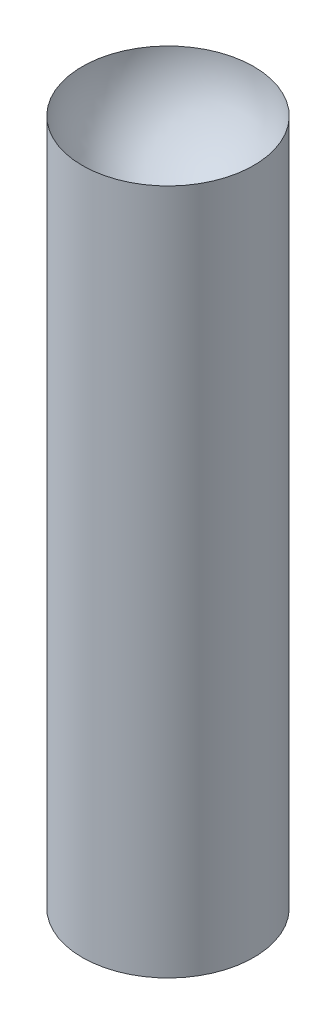
from build123d import *

# Parameters (mm, degrees)
SKETCH1_R           = 12.7
BOSS_EXTRUDE1_DEPTH = 101.6


with BuildPart() as part:
    # Sketch1 → Boss-Extrude1 (new body)
    with BuildSketch(Plane(origin=(0, 0, 0), x_dir=(1, 0, 0), z_dir=(0, 1, 0))):
        with Locations(Location((0, 0, 0), (0, 0, 270))):
            Circle(SKETCH1_R)
    extrude(amount=BOSS_EXTRUDE1_DEPTH)

    # Sketch2 → Cut-Revolve1 (revolve, cut)
    with BuildSketch(Plane(origin=(0, 101.6, 0), x_dir=(1, 0, 0), z_dir=(0, 1, 0))):
        with BuildLine():
            Line((0, 12.7), (0, -12.7))
            ThreePointArc((0, -12.7), (-12.7, 0), (0, 12.7))
        make_face()
    revolve(axis=Axis((0, 101.6, -12.7), (0, 0, 1)), mode=Mode.SUBTRACT)

    # Sketch4 → Cut-Revolve3 (revolve, cut)
    with BuildSketch(Plane(origin=(0, 0, 0), x_dir=(-1, 0, 0), z_dir=(0, -1, 0))):
        with BuildLine():
            Line((0, 11.43), (0, -11.43))
            ThreePointArc((0, -11.43), (11.43, 0), (0, 11.43))
        make_face()
    revolve(axis=Axis((0, 0, -11.43), (0, 0, 1)), mode=Mode.SUBTRACT)


solid = part.part
